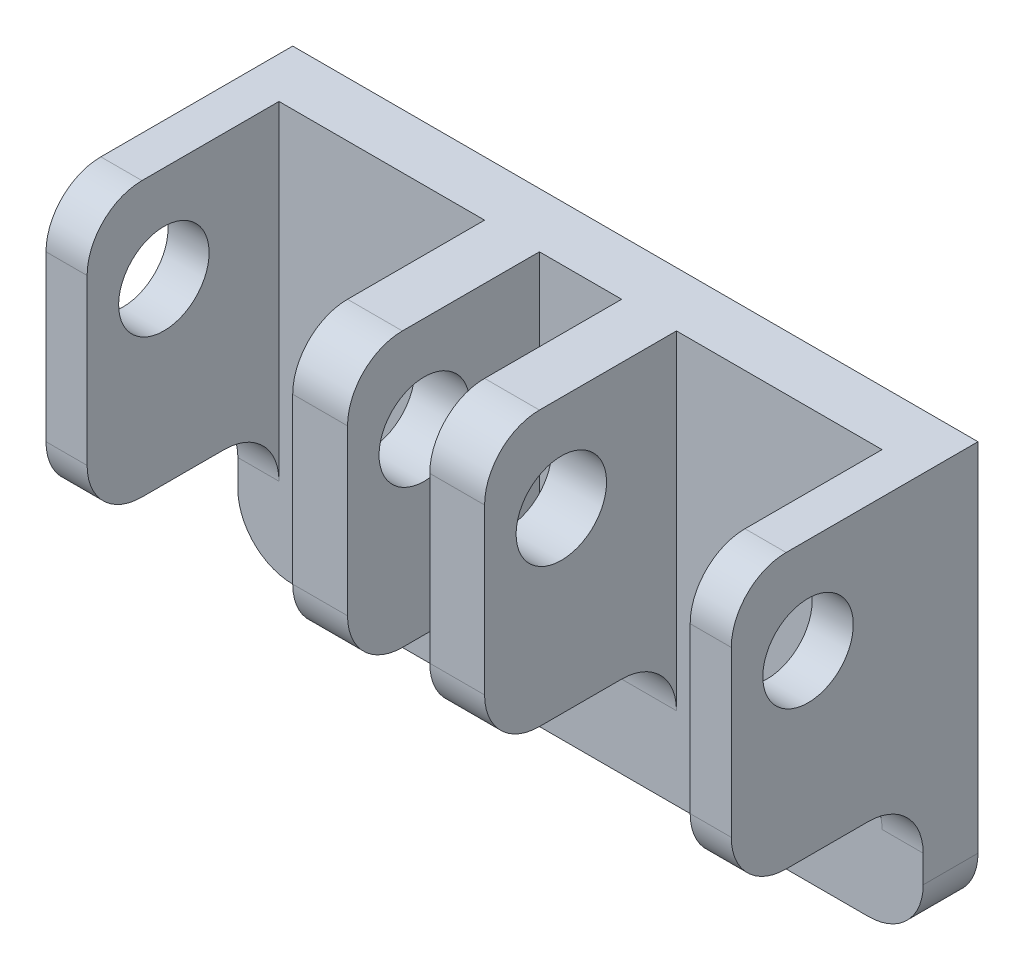
from build123d import *

# Parameters (mm, degrees)
SKETCH_2_W          = 25
SKETCH_2_H          = 15
SKETCH_2_R          = 1.6
EXTRUDE_1_DEPTH     = 2
SKETCH_3_W          = 1.5
SKETCH_3_H          = 10
SKETCH_3_W_2        = 2
EXTRUDE_2_DEPTH     = 7
FILLET_1_R          = 2
SKETCH_4_R          = 1.65
CUT_EXTRUDE_1_DEPTH = 28.608875385


with BuildPart() as part:
    # 草图2 → 凸台-拉伸1 (new body)
    with BuildSketch(Plane.XY):
        Rectangle(SKETCH_2_W, SKETCH_2_H)
        with Locations((-8, -3.5)):
            Circle(SKETCH_2_R, mode=Mode.SUBTRACT)
        with Locations((8, -3.5)):
            Circle(SKETCH_2_R, mode=Mode.SUBTRACT)
    extrude(amount=EXTRUDE_1_DEPTH)

    # 草图3 → 凸台-拉伸2 (add)
    with BuildSketch(Plane.XY.offset(2)):
        with Locations((-11.75, 2.5)):
            Rectangle(SKETCH_3_W, SKETCH_3_H)
        with Locations((-2.5, 2.5)):
            Rectangle(SKETCH_3_W_2, SKETCH_3_H)
        with Locations((2.5, 2.5)):
            Rectangle(SKETCH_3_W_2, SKETCH_3_H)
        with Locations((11.75, 2.5)):
            Rectangle(SKETCH_3_W, SKETCH_3_H)
    extrude(amount=EXTRUDE_2_DEPTH)

    # 圆角1
    fillet_1_edges = [part.edges().sort_by_distance(p)[0] for p in [
        (-11.75, -2.5, 2),
        (-11.75, -2.5, 9),
        (-11.75, 7.5, 9),
        (-2.5, -2.5, 2),
        (-2.5, -2.5, 9),
        (-2.5, 7.5, 9),
        (2.5, -2.5, 2),
        (2.5, -2.5, 9),
        (2.5, 7.5, 9),
        (11.75, -2.5, 2),
        (11.75, 7.5, 9),
        (11.75, -2.5, 9),
        (12.5, -7.5, 1),
        (-12.5, -7.5, 1),
    ]]
    fillet(fillet_1_edges, radius=FILLET_1_R)

    # 草图4 → 切除-拉伸1 (cut, through all)
    with BuildSketch(Plane.ZY.offset(12.5)):
        with Locations(Location((6.2, 4, 0), (0, 0, 270))):
            Circle(SKETCH_4_R)
    extrude(amount=-CUT_EXTRUDE_1_DEPTH, mode=Mode.SUBTRACT)


solid = part.part
